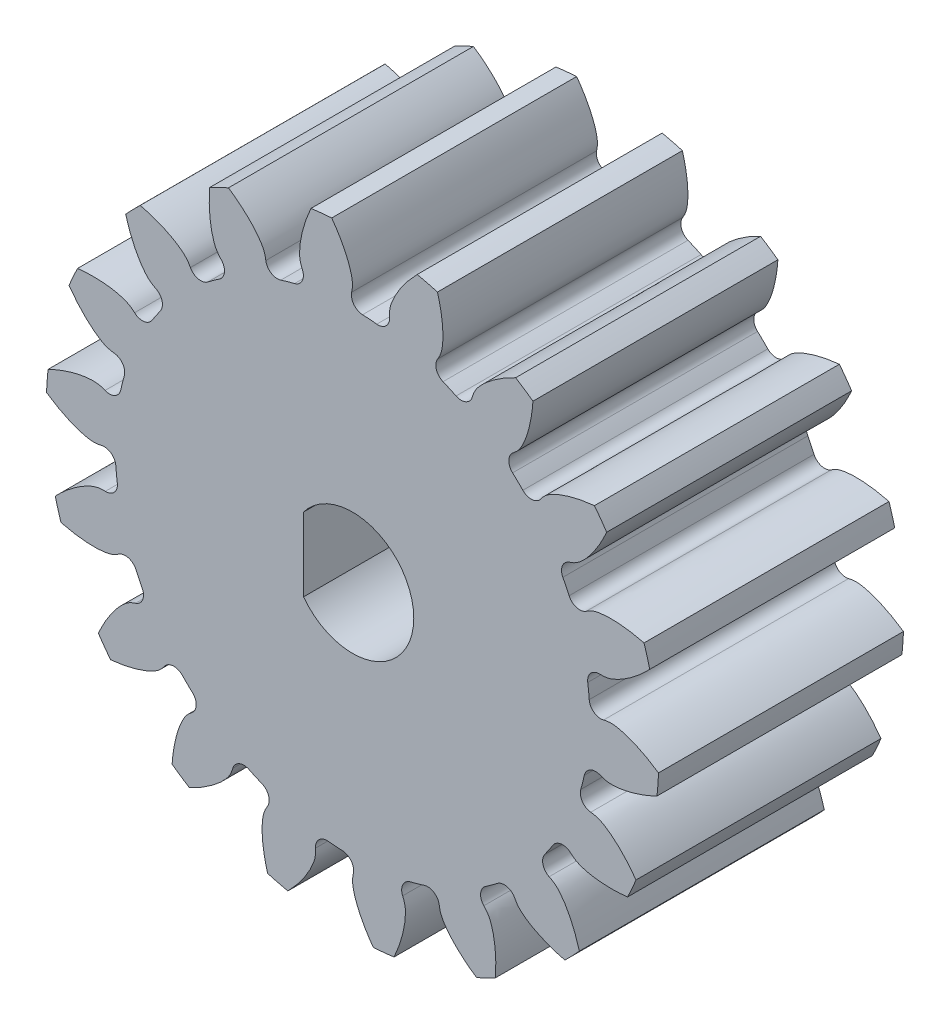
from build123d import *

# Parameters (mm, degrees)
EXTRUDE_1_DEPTH = 4


with BuildPart() as part:
    # 草图1 → 凸台-拉伸1 (new body)
    with BuildSketch(Plane.XY):
        with BuildLine():
            ThreePointArc((4.15001248, 2.788798382), (4.052569634, 2.928596825), (3.950419531, 3.064993561))
            add(Edge.make_bspline(
                [(3.07131722, 2.718405191), (3.105937645, 2.765896197), (3.147428062, 2.810366487), (3.196777722, 2.842281696), (3.311423113, 2.916424689), (3.443434669, 2.963433129), (3.575340926, 2.998667892), (3.698005966, 3.031434144), (3.824051152, 3.052690227), (3.950419531, 3.064993561)],
                knots=[0, 0, 0, 0, 0.000176311, 0.000176311, 0.000176311, 0.000584088, 0.000584088, 0.000584088, 0.000961455, 0.000961455, 0.000961455, 0.000961455], degree=3))
            ThreePointArc((3.07131722, 2.718405191), (2.931097275, 2.640797186), (2.781404278, 2.698039147))
            ThreePointArc((2.781404278, 2.698039147), (2.698903782, 2.780565298), (2.613955789, 2.860569896))
            ThreePointArc((2.613955789, 2.860569896), (2.552278437, 3.008490617), (2.625673457, 3.150960987))
            add(Edge.make_bspline(
                [(2.945910881, 4.040001124), (2.94081791, 3.964384318), (2.9325319, 3.888889047), (2.920518299, 3.814059153), (2.908499503, 3.739196902), (2.892786773, 3.664779849), (2.872510855, 3.591720317), (2.848183716, 3.504063155), (2.817711592, 3.417383146), (2.776710593, 3.336176582), (2.749327615, 3.281941867), (2.715071185, 3.229242242), (2.670231852, 3.188246315), (2.655938612, 3.17517822), (2.640976354, 3.162830829), (2.625673457, 3.150960987)],
                knots=[0, 0, 0, 0, 0.000227364, 0.000227364, 0.000227364, 0.000454898, 0.000454898, 0.000454898, 0.000728492, 0.000728492, 0.000728492, 0.000912375, 0.000912375, 0.000912375, 0.000969803, 0.000969803, 0.000969803, 0.000969803], degree=3))
            ThreePointArc((2.945910881, 4.040001124), (2.806530674, 4.138041273), (2.663890546, 4.231274886))
            add(Edge.make_bspline(
                [(1.956344795, 3.604917654), (1.972634472, 3.661385485), (1.996412975, 3.717364446), (2.031870843, 3.764233511), (2.114243873, 3.873116167), (2.222216325, 3.962440262), (2.334116662, 4.040664706), (2.438177377, 4.113408826), (2.5493511, 4.176493003), (2.663890546, 4.231274886)],
                knots=[0, 0, 0, 0, 0.000176311, 0.000176311, 0.000176311, 0.000584088, 0.000584088, 0.000584088, 0.000961455, 0.000961455, 0.000961455, 0.000961455], degree=3))
            ThreePointArc((1.956344795, 3.604917654), (1.851124648, 3.484031939), (1.69088134, 3.486623767))
            ThreePointArc((1.69088134, 3.486623767), (1.585130627, 3.53595615), (1.47794244, 3.582081956))
            ThreePointArc((1.47794244, 3.582081956), (1.369392822, 3.699987069), (1.389633844, 3.858968))
            add(Edge.make_bspline(
                [(1.386488953, 4.803920106), (1.407565596, 4.731121652), (1.425600197, 4.657345322), (1.439904436, 4.582919328), (1.45421486, 4.508461153), (1.464901854, 4.433157928), (1.470836556, 4.357569652), (1.477957038, 4.266878492), (1.478968917, 4.175003847), (1.468214861, 4.084671471), (1.461032645, 4.024341979), (1.446866462, 3.963104142), (1.418752706, 3.909244616), (1.409791005, 3.892076048), (1.399954138, 3.875355902), (1.389633844, 3.858968)],
                knots=[0, 0, 0, 0, 0.000227364, 0.000227364, 0.000227364, 0.000454898, 0.000454898, 0.000454898, 0.000728492, 0.000728492, 0.000728492, 0.000912375, 0.000912375, 0.000912375, 0.000969803, 0.000969803, 0.000969803, 0.000969803], degree=3))
            ThreePointArc((1.386488953, 4.803920106), (1.221982695, 4.848376872), (1.056057045, 4.887202013))
            add(Edge.make_bspline(
                [(0.605408315, 4.056623845), (0.601402469, 4.115257647), (0.60460102, 4.175993391), (0.621890353, 4.23216321), (0.66205562, 4.362652674), (0.732965896, 4.483518621), (0.811363482, 4.595297723), (0.884268613, 4.699245696), (0.96716168, 4.796549084), (1.056057045, 4.887202013)],
                knots=[0, 0, 0, 0, 0.000176311, 0.000176311, 0.000176311, 0.000584088, 0.000584088, 0.000584088, 0.000961455, 0.000961455, 0.000961455, 0.000961455], degree=3))
            ThreePointArc((0.605408315, 4.056623845), (0.547879068, 3.907041021), (0.396413157, 3.854670104))
            ThreePointArc((0.396413157, 3.854670104), (0.280167324, 3.864858506), (0.163667421, 3.871542067))
            ThreePointArc((0.163667421, 3.871542067), (0.021338222, 3.945210475), (-0.01401612, 4.10152652))
            add(Edge.make_bspline(
                [(-0.340164005, 4.988415425), (-0.295459901, 4.927215892), (-0.253279929, 4.864057015), (-0.214383152, 4.799011796), (-0.175469556, 4.733938452), (-0.139671847, 4.666831733), (-0.108242339, 4.597831776), (-0.070533071, 4.51504531), (-0.038159236, 4.429057468), (-0.017369251, 4.340494697), (-0.003484426, 4.281347056), (0.004148292, 4.218957192), (-0.003848955, 4.158730322), (-0.006398203, 4.139532064), (-0.009923208, 4.120455859), (-0.01401612, 4.10152652)],
                knots=[0, 0, 0, 0, 0.000227364, 0.000227364, 0.000227364, 0.000454898, 0.000454898, 0.000454898, 0.000728492, 0.000728492, 0.000728492, 0.000912375, 0.000912375, 0.000912375, 0.000969803, 0.000969803, 0.000969803, 0.000969803], degree=3))
            ThreePointArc((-0.340164005, 4.988415425), (-0.509954431, 4.973926666), (-0.67915252, 4.95366045))
            add(Edge.make_bspline(
                [(-0.818549343, 4.019041331), (-0.842367548, 4.072769002), (-0.860134741, 4.130935901), (-0.863099292, 4.189631566), (-0.869986313, 4.325988883), (-0.844691037, 4.463818464), (-0.809252109, 4.595670015), (-0.776295996, 4.718284182), (-0.731681711, 4.838070556), (-0.67915252, 4.95366045)],
                knots=[0, 0, 0, 0, 0.000176311, 0.000176311, 0.000176311, 0.000584088, 0.000584088, 0.000584088, 0.000961455, 0.000961455, 0.000961455, 0.000961455], degree=3))
            ThreePointArc((-0.818549343, 4.019041331), (-0.821448812, 3.858803294), (-0.945868303, 3.757786337))
            ThreePointArc((-0.945868303, 3.757786337), (-1.058588294, 3.727601887), (-1.170348305, 3.694037066))
            ThreePointArc((-1.170348305, 3.694037066), (-1.329290083, 3.714583273), (-1.415975533, 3.849380409))
            add(Edge.make_bspline(
                [(-2.025788164, 4.571234222), (-1.962848575, 4.529015177), (-1.901610758, 4.484091646), (-1.842812968, 4.436272615), (-1.783989755, 4.388432908), (-1.727399062, 4.337616757), (-1.67426561, 4.283527531), (-1.61051585, 4.21863103), (-1.550684823, 4.148901392), (-1.500858375, 4.072790204), (-1.467581223, 4.021958492), (-1.439070225, 3.96594174), (-1.425986376, 3.906611776), (-1.421815694, 3.887699419), (-1.418603668, 3.868568028), (-1.415975533, 3.849380409)],
                knots=[0, 0, 0, 0, 0.000227364, 0.000227364, 0.000227364, 0.000454898, 0.000454898, 0.000454898, 0.000728492, 0.000728492, 0.000728492, 0.000912375, 0.000912375, 0.000912375, 0.000969803, 0.000969803, 0.000969803, 0.000969803], degree=3))
            ThreePointArc((-2.025788164, 4.571234222), (-2.180383527, 4.499547497), (-2.332446269, 4.422634328))
            add(Edge.make_bspline(
                [(-2.143777869, 3.496703118), (-2.184535607, 3.539044308), (-2.221125558, 3.587626576), (-2.243986425, 3.641768523), (-2.297095056, 3.767546988), (-2.320465766, 3.905715922), (-2.332259953, 4.041736678), (-2.343227851, 4.168227961), (-2.34227349, 4.296049317), (-2.332446269, 4.422634328)],
                knots=[0, 0, 0, 0, 0.000176311, 0.000176311, 0.000176311, 0.000584088, 0.000584088, 0.000584088, 0.000961455, 0.000961455, 0.000961455, 0.000961455], degree=3))
            ThreePointArc((-2.143777869, 3.496703118), (-2.091697843, 3.34513694), (-2.174064086, 3.207658079))
            ThreePointArc((-2.174064086, 3.207658079), (-2.269662539, 3.140741466), (-2.363202753, 3.070976677))
            ThreePointArc((-2.363202753, 3.070976677), (-2.519586385, 3.035922506), (-2.647147399, 3.132942211))
            add(Edge.make_bspline(
                [(-3.467072373, 3.602694708), (-3.393488741, 3.58454839), (-3.320579264, 3.563278647), (-3.248972344, 3.538453485), (-3.177334461, 3.513617588), (-3.106776457, 3.485221184), (-3.03834774, 3.452566648), (-2.95624665, 3.413387586), (-2.876174934, 3.368326577), (-2.803321829, 3.313847104), (-2.754666065, 3.277462376), (-2.708715633, 3.234575183), (-2.676128794, 3.183298193), (-2.665741228, 3.166952849), (-2.65617959, 3.150073799), (-2.647147399, 3.132942211)],
                knots=[0, 0, 0, 0, 0.000227364, 0.000227364, 0.000227364, 0.000454898, 0.000454898, 0.000454898, 0.000728492, 0.000728492, 0.000728492, 0.000912375, 0.000912375, 0.000912375, 0.000969803, 0.000969803, 0.000969803, 0.000969803], degree=3))
            ThreePointArc((-3.467072373, 3.602694708), (-3.587826191, 3.482456493), (-3.704412574, 3.358173236))
            add(Edge.make_bspline(
                [(-3.210435146, 2.552610903), (-3.263216431, 2.578458639), (-3.314215853, 2.611596538), (-3.354215676, 2.654654449), (-3.447140234, 2.754683323), (-3.516358076, 2.876526397), (-3.573962825, 3.000310248), (-3.627531845, 3.115421931), (-3.670352517, 3.235861127), (-3.704412574, 3.358173236)],
                knots=[0, 0, 0, 0, 0.000176311, 0.000176311, 0.000176311, 0.000584088, 0.000584088, 0.000584088, 0.000961455, 0.000961455, 0.000961455, 0.000961455], degree=3))
            ThreePointArc((-3.210435146, 2.552610903), (-3.109657244, 2.427997702), (-3.140035655, 2.270638916))
            ThreePointArc((-3.140035655, 2.270638916), (-3.206981986, 2.175061273), (-3.271020071, 2.077511178))
            ThreePointArc((-3.271020071, 2.077511178), (-3.405983384, 1.99108468), (-3.559034221, 2.038624944))
            add(Edge.make_bspline(
                [(-4.490176485, 2.199617042), (-4.414824083, 2.207732166), (-4.339036905, 2.212681655), (-4.263257705, 2.213844642), (-4.187445737, 2.215008132), (-4.11143076, 2.212456499), (-4.03596029, 2.205175273), (-3.945410473, 2.196439224), (-3.8547559, 2.181481866), (-3.767663298, 2.155205136), (-3.709497526, 2.137655927), (-3.65164996, 2.113071122), (-3.603490584, 2.076031868), (-3.588139028, 2.064225025), (-3.573381053, 2.05163418), (-3.559034221, 2.038624944)],
                knots=[0, 0, 0, 0, 0.000227364, 0.000227364, 0.000227364, 0.000454898, 0.000454898, 0.000454898, 0.000728492, 0.000728492, 0.000728492, 0.000912375, 0.000912375, 0.000912375, 0.000969803, 0.000969803, 0.000969803, 0.000969803], degree=3))
            ThreePointArc((-4.490176485, 2.199617042), (-4.562524065, 2.045329841), (-4.629572052, 1.888666889))
            add(Edge.make_bspline(
                [(-3.889866563, 1.30063614), (-3.948305194, 1.306872805), (-4.007562803, 1.320569414), (-4.059877015, 1.34734987), (-4.181409426, 1.409564194), (-4.288125707, 1.500385335), (-4.384593035, 1.597002123), (-4.474301962, 1.686850038), (-4.555732863, 1.785380329), (-4.629572052, 1.888666889)],
                knots=[0, 0, 0, 0, 0.000176311, 0.000176311, 0.000176311, 0.000584088, 0.000584088, 0.000584088, 0.000961455, 0.000961455, 0.000961455, 0.000961455], degree=3))
            ThreePointArc((-3.889866563, 1.30063614), (-3.752546087, 1.218006108), (-3.727272581, 1.059747189))
            ThreePointArc((-3.727272581, 1.059747189), (-3.757492076, 0.947036589), (-3.784304094, 0.83346717))
            ThreePointArc((-3.784304094, 0.83346717), (-3.88156852, 0.706092656), (-4.04164899, 0.698419422))
            add(Edge.make_bspline(
                [(-4.971699045, 0.531233098), (-4.903666484, 0.564630859), (-4.834142657, 0.595202599), (-4.763331267, 0.622213463), (-4.692489258, 0.649236006), (-4.620185835, 0.672836908), (-4.546776465, 0.691807214), (-4.458699566, 0.714567875), (-4.368396414, 0.731518246), (-4.277568968, 0.736613621), (-4.216908838, 0.740016625), (-4.154141409, 0.736699498), (-4.096218228, 0.718365461), (-4.077754306, 0.712521199), (-4.059580023, 0.705737199), (-4.04164899, 0.698419422)],
                knots=[0, 0, 0, 0, 0.000227364, 0.000227364, 0.000227364, 0.000454898, 0.000454898, 0.000454898, 0.000728492, 0.000728492, 0.000728492, 0.000912375, 0.000912375, 0.000912375, 0.000969803, 0.000969803, 0.000969803, 0.000969803], degree=3))
            ThreePointArc((-4.971699045, 0.531233098), (-4.986914201, 0.361506224), (-4.996336814, 0.191359443))
            add(Edge.make_bspline(
                [(-4.100122664, -0.108214536), (-4.157170079, -0.122341177), (-4.217538533, -0.12973787), (-4.275857268, -0.122464988), (-4.411338929, -0.105569179), (-4.542682091, -0.056724341), (-4.666376615, 0.001071972), (-4.781405228, 0.054819135), (-4.891624589, 0.119556314), (-4.996336814, 0.191359443)],
                knots=[0, 0, 0, 0, 0.000176311, 0.000176311, 0.000176311, 0.000584088, 0.000584088, 0.000584088, 0.000961455, 0.000961455, 0.000961455, 0.000961455], degree=3))
            ThreePointArc((-4.100122664, -0.108214536), (-3.942822491, -0.138894999), (-3.864945426, -0.278965689))
            ThreePointArc((-3.864945426, -0.278965689), (-3.854793166, -0.395214684), (-3.841145193, -0.51110528))
            ThreePointArc((-3.841145193, -0.51110528), (-3.888979207, -0.664064563), (-4.036781242, -0.72602579))
            add(Edge.make_bspline(
                [(-4.853561326, -1.201225397), (-4.801054338, -1.146573262), (-4.746179461, -1.094066674), (-4.68887678, -1.044465843), (-4.631549321, -0.994843565), (-4.571678311, -0.947936744), (-4.509184295, -0.905003004), (-4.434203688, -0.853490905), (-4.355143851, -0.80667727), (-4.271536691, -0.770824367), (-4.21569871, -0.746879604), (-4.155582096, -0.728528958), (-4.0948815, -0.725946423), (-4.075532234, -0.725123199), (-4.056133729, -0.725282103), (-4.036781242, -0.72602579)],
                knots=[0, 0, 0, 0, 0.000227364, 0.000227364, 0.000227364, 0.000454898, 0.000454898, 0.000454898, 0.000728492, 0.000728492, 0.000728492, 0.000912375, 0.000912375, 0.000912375, 0.000969803, 0.000969803, 0.000969803, 0.000969803], degree=3))
            ThreePointArc((-4.853561326, -1.201225397), (-4.809808886, -1.365920379), (-4.76046962, -1.529028777))
            add(Edge.make_bspline(
                [(-3.81584346, -1.504012942), (-3.8646189, -1.536799008), (-3.918816873, -1.564396853), (-3.976106029, -1.577508761), (-4.109195854, -1.607969352), (-4.249323972, -1.606992224), (-4.385326307, -1.594987475), (-4.511800458, -1.583823765), (-4.637514198, -1.560687957), (-4.76046962, -1.529028777)],
                knots=[0, 0, 0, 0, 0.000176311, 0.000176311, 0.000176311, 0.000584088, 0.000584088, 0.000584088, 0.000961455, 0.000961455, 0.000961455, 0.000961455], degree=3))
            ThreePointArc((-3.81584346, -1.504012942), (-3.657536312, -1.479043319), (-3.536448812, -1.584031188))
            ThreePointArc((-3.536448812, -1.584031188), (-3.48714931, -1.689797233), (-3.434687492, -1.794030889))
            ThreePointArc((-3.434687492, -1.794030889), (-3.427321606, -1.954125795), (-3.5450181, -2.062901576))
            add(Edge.make_bspline(
                [(-4.15001248, -2.788798382), (-4.119364182, -2.719483726), (-4.085756976, -2.65137536), (-4.048874552, -2.585167154), (-4.011976181, -2.518930319), (-3.971758913, -2.454375234), (-3.927717951, -2.392656504), (-3.874877403, -2.318606086), (-3.816596664, -2.247575602), (-3.750294047, -2.185289561), (-3.7060131, -2.143691129), (-3.655798252, -2.10588607), (-3.599641629, -2.082698454), (-3.581740825, -2.075307038), (-3.563457845, -2.068821679), (-3.5450181, -2.062901576)],
                knots=[0, 0, 0, 0, 0.000227364, 0.000227364, 0.000227364, 0.000454898, 0.000454898, 0.000454898, 0.000728492, 0.000728492, 0.000728492, 0.000912375, 0.000912375, 0.000912375, 0.000969803, 0.000969803, 0.000969803, 0.000969803], degree=3))
            ThreePointArc((-4.15001248, -2.788798382), (-4.052569634, -2.928596825), (-3.950419531, -3.064993561))
            add(Edge.make_bspline(
                [(-3.07131722, -2.718405191), (-3.105937645, -2.765896197), (-3.147428062, -2.810366487), (-3.196777722, -2.842281696), (-3.311423113, -2.916424689), (-3.443434669, -2.963433129), (-3.575340926, -2.998667892), (-3.698005966, -3.031434144), (-3.824051152, -3.052690227), (-3.950419531, -3.064993561)],
                knots=[0, 0, 0, 0, 0.000176311, 0.000176311, 0.000176311, 0.000584088, 0.000584088, 0.000584088, 0.000961455, 0.000961455, 0.000961455, 0.000961455], degree=3))
            ThreePointArc((-3.07131722, -2.718405191), (-2.931097275, -2.640797186), (-2.781404278, -2.698039147))
            ThreePointArc((-2.781404278, -2.698039147), (-2.698903782, -2.780565298), (-2.613955789, -2.860569896))
            ThreePointArc((-2.613955789, -2.860569896), (-2.552278437, -3.008490617), (-2.625673457, -3.150960987))
            add(Edge.make_bspline(
                [(-2.945910881, -4.040001124), (-2.94081791, -3.964384318), (-2.9325319, -3.888889047), (-2.920518299, -3.814059153), (-2.908499503, -3.739196902), (-2.892786773, -3.664779849), (-2.872510855, -3.591720317), (-2.848183716, -3.504063155), (-2.817711592, -3.417383146), (-2.776710593, -3.336176582), (-2.749327615, -3.281941867), (-2.715071185, -3.229242242), (-2.670231852, -3.188246315), (-2.655938612, -3.17517822), (-2.640976354, -3.162830829), (-2.625673457, -3.150960987)],
                knots=[0, 0, 0, 0, 0.000227364, 0.000227364, 0.000227364, 0.000454898, 0.000454898, 0.000454898, 0.000728492, 0.000728492, 0.000728492, 0.000912375, 0.000912375, 0.000912375, 0.000969803, 0.000969803, 0.000969803, 0.000969803], degree=3))
            ThreePointArc((-2.945910881, -4.040001124), (-2.806530674, -4.138041273), (-2.663890546, -4.231274886))
            add(Edge.make_bspline(
                [(-1.956344795, -3.604917654), (-1.972634472, -3.661385485), (-1.996412975, -3.717364446), (-2.031870843, -3.764233511), (-2.114243873, -3.873116167), (-2.222216325, -3.962440262), (-2.334116662, -4.040664706), (-2.438177377, -4.113408826), (-2.5493511, -4.176493003), (-2.663890546, -4.231274886)],
                knots=[0, 0, 0, 0, 0.000176311, 0.000176311, 0.000176311, 0.000584088, 0.000584088, 0.000584088, 0.000961455, 0.000961455, 0.000961455, 0.000961455], degree=3))
            ThreePointArc((-1.956344795, -3.604917654), (-1.851124648, -3.484031939), (-1.69088134, -3.486623767))
            ThreePointArc((-1.69088134, -3.486623767), (-1.585130627, -3.53595615), (-1.47794244, -3.582081956))
            ThreePointArc((-1.47794244, -3.582081956), (-1.369392822, -3.699987069), (-1.389633844, -3.858968))
            add(Edge.make_bspline(
                [(-1.386488953, -4.803920106), (-1.407565596, -4.731121652), (-1.425600197, -4.657345322), (-1.439904436, -4.582919328), (-1.45421486, -4.508461153), (-1.464901854, -4.433157928), (-1.470836556, -4.357569652), (-1.477957038, -4.266878492), (-1.478968917, -4.175003847), (-1.468214861, -4.084671471), (-1.461032645, -4.024341979), (-1.446866462, -3.963104142), (-1.418752706, -3.909244616), (-1.409791005, -3.892076048), (-1.399954138, -3.875355902), (-1.389633844, -3.858968)],
                knots=[0, 0, 0, 0, 0.000227364, 0.000227364, 0.000227364, 0.000454898, 0.000454898, 0.000454898, 0.000728492, 0.000728492, 0.000728492, 0.000912375, 0.000912375, 0.000912375, 0.000969803, 0.000969803, 0.000969803, 0.000969803], degree=3))
            ThreePointArc((-1.386488953, -4.803920106), (-1.221982695, -4.848376872), (-1.056057045, -4.887202013))
            add(Edge.make_bspline(
                [(-0.605408315, -4.056623845), (-0.601402469, -4.115257647), (-0.60460102, -4.175993391), (-0.621890353, -4.23216321), (-0.66205562, -4.362652674), (-0.732965896, -4.483518621), (-0.811363482, -4.595297723), (-0.884268613, -4.699245696), (-0.96716168, -4.796549084), (-1.056057045, -4.887202013)],
                knots=[0, 0, 0, 0, 0.000176311, 0.000176311, 0.000176311, 0.000584088, 0.000584088, 0.000584088, 0.000961455, 0.000961455, 0.000961455, 0.000961455], degree=3))
            ThreePointArc((-0.605408315, -4.056623845), (-0.547879068, -3.907041021), (-0.396413157, -3.854670104))
            ThreePointArc((-0.396413157, -3.854670104), (-0.280167324, -3.864858506), (-0.163667421, -3.871542067))
            ThreePointArc((-0.163667421, -3.871542067), (-0.021338222, -3.945210475), (0.01401612, -4.10152652))
            add(Edge.make_bspline(
                [(0.340164005, -4.988415425), (0.295459901, -4.927215892), (0.253279929, -4.864057015), (0.214383152, -4.799011796), (0.175469556, -4.733938452), (0.139671847, -4.666831733), (0.108242339, -4.597831776), (0.070533071, -4.51504531), (0.038159236, -4.429057468), (0.017369251, -4.340494697), (0.003484426, -4.281347056), (-0.004148292, -4.218957192), (0.003848955, -4.158730322), (0.006398203, -4.139532064), (0.009923208, -4.120455859), (0.01401612, -4.10152652)],
                knots=[0, 0, 0, 0, 0.000227364, 0.000227364, 0.000227364, 0.000454898, 0.000454898, 0.000454898, 0.000728492, 0.000728492, 0.000728492, 0.000912375, 0.000912375, 0.000912375, 0.000969803, 0.000969803, 0.000969803, 0.000969803], degree=3))
            ThreePointArc((0.340164005, -4.988415425), (0.509954431, -4.973926666), (0.67915252, -4.95366045))
            add(Edge.make_bspline(
                [(0.818549343, -4.019041331), (0.842367548, -4.072769002), (0.860134741, -4.130935901), (0.863099292, -4.189631566), (0.869986313, -4.325988883), (0.844691037, -4.463818464), (0.809252109, -4.595670015), (0.776295996, -4.718284182), (0.731681711, -4.838070556), (0.67915252, -4.95366045)],
                knots=[0, 0, 0, 0, 0.000176311, 0.000176311, 0.000176311, 0.000584088, 0.000584088, 0.000584088, 0.000961455, 0.000961455, 0.000961455, 0.000961455], degree=3))
            ThreePointArc((0.818549343, -4.019041331), (0.821448812, -3.858803294), (0.945868303, -3.757786337))
            ThreePointArc((0.945868303, -3.757786337), (1.058588294, -3.727601887), (1.170348305, -3.694037066))
            ThreePointArc((1.170348305, -3.694037066), (1.329290083, -3.714583273), (1.415975533, -3.849380409))
            add(Edge.make_bspline(
                [(2.025788164, -4.571234222), (1.962848575, -4.529015177), (1.901610758, -4.484091646), (1.842812968, -4.436272615), (1.783989755, -4.388432908), (1.727399062, -4.337616757), (1.67426561, -4.283527531), (1.61051585, -4.21863103), (1.550684823, -4.148901392), (1.500858375, -4.072790204), (1.467581223, -4.021958492), (1.439070225, -3.96594174), (1.425986376, -3.906611776), (1.421815694, -3.887699419), (1.418603668, -3.868568028), (1.415975533, -3.849380409)],
                knots=[0, 0, 0, 0, 0.000227364, 0.000227364, 0.000227364, 0.000454898, 0.000454898, 0.000454898, 0.000728492, 0.000728492, 0.000728492, 0.000912375, 0.000912375, 0.000912375, 0.000969803, 0.000969803, 0.000969803, 0.000969803], degree=3))
            ThreePointArc((2.025788164, -4.571234222), (2.180383527, -4.499547497), (2.332446269, -4.422634328))
            add(Edge.make_bspline(
                [(2.143777869, -3.496703118), (2.184535607, -3.539044308), (2.221125558, -3.587626576), (2.243986425, -3.641768523), (2.297095056, -3.767546988), (2.320465766, -3.905715922), (2.332259953, -4.041736678), (2.343227851, -4.168227961), (2.34227349, -4.296049317), (2.332446269, -4.422634328)],
                knots=[0, 0, 0, 0, 0.000176311, 0.000176311, 0.000176311, 0.000584088, 0.000584088, 0.000584088, 0.000961455, 0.000961455, 0.000961455, 0.000961455], degree=3))
            ThreePointArc((2.143777869, -3.496703118), (2.091697843, -3.34513694), (2.174064086, -3.207658079))
            ThreePointArc((2.174064086, -3.207658079), (2.269662539, -3.140741466), (2.363202753, -3.070976677))
            ThreePointArc((2.363202753, -3.070976677), (2.519586385, -3.035922506), (2.647147399, -3.132942211))
            add(Edge.make_bspline(
                [(3.467072373, -3.602694708), (3.393488741, -3.58454839), (3.320579264, -3.563278647), (3.248972344, -3.538453485), (3.177334461, -3.513617588), (3.106776457, -3.485221184), (3.03834774, -3.452566648), (2.95624665, -3.413387586), (2.876174934, -3.368326577), (2.803321829, -3.313847104), (2.754666065, -3.277462376), (2.708715633, -3.234575183), (2.676128794, -3.183298193), (2.665741228, -3.166952849), (2.65617959, -3.150073799), (2.647147399, -3.132942211)],
                knots=[0, 0, 0, 0, 0.000227364, 0.000227364, 0.000227364, 0.000454898, 0.000454898, 0.000454898, 0.000728492, 0.000728492, 0.000728492, 0.000912375, 0.000912375, 0.000912375, 0.000969803, 0.000969803, 0.000969803, 0.000969803], degree=3))
            ThreePointArc((3.467072373, -3.602694708), (3.587826191, -3.482456493), (3.704412574, -3.358173236))
            add(Edge.make_bspline(
                [(3.210435146, -2.552610903), (3.263216431, -2.578458639), (3.314215853, -2.611596538), (3.354215676, -2.654654449), (3.447140234, -2.754683323), (3.516358076, -2.876526397), (3.573962825, -3.000310248), (3.627531845, -3.115421931), (3.670352517, -3.235861127), (3.704412574, -3.358173236)],
                knots=[0, 0, 0, 0, 0.000176311, 0.000176311, 0.000176311, 0.000584088, 0.000584088, 0.000584088, 0.000961455, 0.000961455, 0.000961455, 0.000961455], degree=3))
            ThreePointArc((3.210435146, -2.552610903), (3.109657244, -2.427997702), (3.140035655, -2.270638916))
            ThreePointArc((3.140035655, -2.270638916), (3.206981986, -2.175061273), (3.271020071, -2.077511178))
            ThreePointArc((3.271020071, -2.077511178), (3.405983384, -1.99108468), (3.559034221, -2.038624944))
            add(Edge.make_bspline(
                [(4.490176485, -2.199617042), (4.414824083, -2.207732166), (4.339036905, -2.212681655), (4.263257705, -2.213844642), (4.187445737, -2.215008132), (4.11143076, -2.212456499), (4.03596029, -2.205175273), (3.945410473, -2.196439224), (3.8547559, -2.181481866), (3.767663298, -2.155205136), (3.709497526, -2.137655927), (3.65164996, -2.113071122), (3.603490584, -2.076031868), (3.588139028, -2.064225025), (3.573381053, -2.05163418), (3.559034221, -2.038624944)],
                knots=[0, 0, 0, 0, 0.000227364, 0.000227364, 0.000227364, 0.000454898, 0.000454898, 0.000454898, 0.000728492, 0.000728492, 0.000728492, 0.000912375, 0.000912375, 0.000912375, 0.000969803, 0.000969803, 0.000969803, 0.000969803], degree=3))
            ThreePointArc((4.490176485, -2.199617042), (4.562524065, -2.045329841), (4.629572052, -1.888666889))
            add(Edge.make_bspline(
                [(3.889866563, -1.30063614), (3.948305194, -1.306872805), (4.007562803, -1.320569414), (4.059877015, -1.34734987), (4.181409426, -1.409564194), (4.288125707, -1.500385335), (4.384593035, -1.597002123), (4.474301962, -1.686850038), (4.555732863, -1.785380329), (4.629572052, -1.888666889)],
                knots=[0, 0, 0, 0, 0.000176311, 0.000176311, 0.000176311, 0.000584088, 0.000584088, 0.000584088, 0.000961455, 0.000961455, 0.000961455, 0.000961455], degree=3))
            ThreePointArc((3.889866563, -1.30063614), (3.752546087, -1.218006108), (3.727272581, -1.059747189))
            ThreePointArc((3.727272581, -1.059747189), (3.757492076, -0.947036589), (3.784304094, -0.83346717))
            ThreePointArc((3.784304094, -0.83346717), (3.88156852, -0.706092656), (4.04164899, -0.698419422))
            add(Edge.make_bspline(
                [(4.971699045, -0.531233098), (4.903666484, -0.564630859), (4.834142657, -0.595202599), (4.763331267, -0.622213463), (4.692489258, -0.649236006), (4.620185835, -0.672836908), (4.546776465, -0.691807214), (4.458699566, -0.714567875), (4.368396414, -0.731518246), (4.277568968, -0.736613621), (4.216908838, -0.740016625), (4.154141409, -0.736699498), (4.096218228, -0.718365461), (4.077754306, -0.712521199), (4.059580023, -0.705737199), (4.04164899, -0.698419422)],
                knots=[0, 0, 0, 0, 0.000227364, 0.000227364, 0.000227364, 0.000454898, 0.000454898, 0.000454898, 0.000728492, 0.000728492, 0.000728492, 0.000912375, 0.000912375, 0.000912375, 0.000969803, 0.000969803, 0.000969803, 0.000969803], degree=3))
            ThreePointArc((4.971699045, -0.531233098), (4.986914201, -0.361506224), (4.996336814, -0.191359443))
            add(Edge.make_bspline(
                [(4.100122664, 0.108214536), (4.157170079, 0.122341177), (4.217538533, 0.12973787), (4.275857268, 0.122464988), (4.411338929, 0.105569179), (4.542682091, 0.056724341), (4.666376615, -0.001071972), (4.781405228, -0.054819135), (4.891624589, -0.119556314), (4.996336814, -0.191359443)],
                knots=[0, 0, 0, 0, 0.000176311, 0.000176311, 0.000176311, 0.000584088, 0.000584088, 0.000584088, 0.000961455, 0.000961455, 0.000961455, 0.000961455], degree=3))
            ThreePointArc((4.100122664, 0.108214536), (3.942822491, 0.138894999), (3.864945426, 0.278965689))
            ThreePointArc((3.864945426, 0.278965689), (3.854793166, 0.395214684), (3.841145193, 0.51110528))
            ThreePointArc((3.841145193, 0.51110528), (3.888979207, 0.664064563), (4.036781242, 0.72602579))
            add(Edge.make_bspline(
                [(4.853561326, 1.201225397), (4.801054338, 1.146573262), (4.746179461, 1.094066674), (4.68887678, 1.044465843), (4.631549321, 0.994843565), (4.571678311, 0.947936744), (4.509184295, 0.905003004), (4.434203688, 0.853490905), (4.355143851, 0.80667727), (4.271536691, 0.770824367), (4.21569871, 0.746879604), (4.155582096, 0.728528958), (4.0948815, 0.725946423), (4.075532234, 0.725123199), (4.056133729, 0.725282103), (4.036781242, 0.72602579)],
                knots=[0, 0, 0, 0, 0.000227364, 0.000227364, 0.000227364, 0.000454898, 0.000454898, 0.000454898, 0.000728492, 0.000728492, 0.000728492, 0.000912375, 0.000912375, 0.000912375, 0.000969803, 0.000969803, 0.000969803, 0.000969803], degree=3))
            ThreePointArc((4.853561326, 1.201225397), (4.809808886, 1.365920379), (4.76046962, 1.529028777))
            add(Edge.make_bspline(
                [(3.81584346, 1.504012942), (3.8646189, 1.536799008), (3.918816873, 1.564396853), (3.976106029, 1.577508761), (4.109195854, 1.607969352), (4.249323972, 1.606992224), (4.385326307, 1.594987475), (4.511800458, 1.583823765), (4.637514198, 1.560687957), (4.76046962, 1.529028777)],
                knots=[0, 0, 0, 0, 0.000176311, 0.000176311, 0.000176311, 0.000584088, 0.000584088, 0.000584088, 0.000961455, 0.000961455, 0.000961455, 0.000961455], degree=3))
            ThreePointArc((3.81584346, 1.504012942), (3.657536312, 1.479043319), (3.536448812, 1.584031188))
            ThreePointArc((3.536448812, 1.584031188), (3.48714931, 1.689797233), (3.434687492, 1.794030889))
            ThreePointArc((3.434687492, 1.794030889), (3.427321606, 1.954125795), (3.5450181, 2.062901576))
            add(Edge.make_bspline(
                [(4.15001248, 2.788798382), (4.119364182, 2.719483726), (4.085756976, 2.65137536), (4.048874552, 2.585167154), (4.011976181, 2.518930319), (3.971758913, 2.454375234), (3.927717951, 2.392656504), (3.874877403, 2.318606086), (3.816596664, 2.247575602), (3.750294047, 2.185289561), (3.7060131, 2.143691129), (3.655798252, 2.10588607), (3.599641629, 2.082698454), (3.581740825, 2.075307038), (3.563457845, 2.068821679), (3.5450181, 2.062901576)],
                knots=[0, 0, 0, 0, 0.000227364, 0.000227364, 0.000227364, 0.000454898, 0.000454898, 0.000454898, 0.000728492, 0.000728492, 0.000728492, 0.000912375, 0.000912375, 0.000912375, 0.000969803, 0.000969803, 0.000969803, 0.000969803], degree=3))
        make_face()
        with BuildLine():
            Line((-0.8, -0.6), (-0.8, 0.6))
            ThreePointArc((-0.8, 0.6), (1, 0), (-0.8, -0.6))
        make_face(mode=Mode.SUBTRACT)
    extrude(amount=-EXTRUDE_1_DEPTH)


solid = part.part
